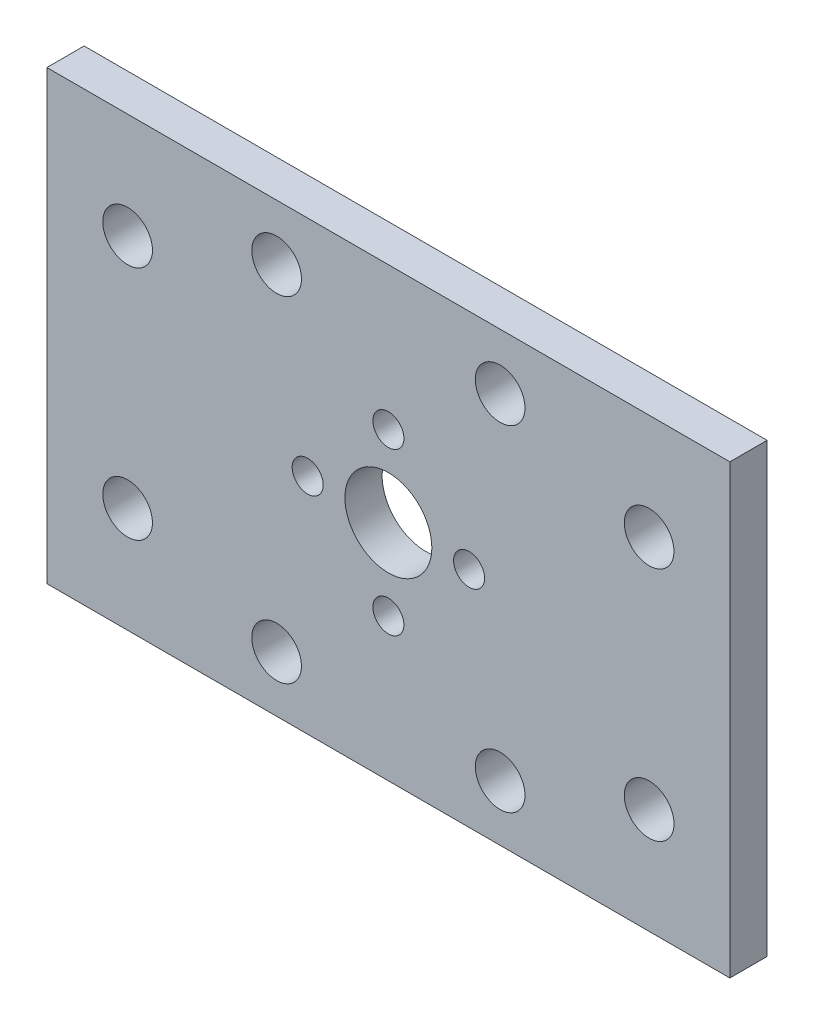
from build123d import *

# Parameters (mm, degrees)
SKETCH1_W           = 55
SKETCH1_H           = 36
SKETCH1_R           = 2
SKETCH1_R_2         = 3.5
SKETCH1_R_3         = 1.25
BOSS_EXTRUDE1_DEPTH = 1.5


with BuildPart() as part:
    # Sketch1 → Boss-Extrude1 (new, symmetric)
    with BuildSketch(Plane.XY):
        Rectangle(SKETCH1_W, SKETCH1_H)
        with Locations((-9, 13.5)):
            Circle(SKETCH1_R, mode=Mode.SUBTRACT)
        with Locations((-21, 9.5)):
            Circle(SKETCH1_R, mode=Mode.SUBTRACT)
        with Locations(Location((-9, -13.5, 0), (0, 0, 180))):
            Circle(SKETCH1_R, mode=Mode.SUBTRACT)
        with Locations(Location((-21, -9.5, 0), (0, 0, 180))):
            Circle(SKETCH1_R, mode=Mode.SUBTRACT)
        with Locations((9, -13.5)):
            Circle(SKETCH1_R, mode=Mode.SUBTRACT)
        with Locations((21, -9.5)):
            Circle(SKETCH1_R, mode=Mode.SUBTRACT)
        with Locations(Location((9, 13.5, 0), (0, 0, 180))):
            Circle(SKETCH1_R, mode=Mode.SUBTRACT)
        with Locations(Location((21, 9.5, 0), (0, 0, 180))):
            Circle(SKETCH1_R, mode=Mode.SUBTRACT)
        Circle(SKETCH1_R_2, mode=Mode.SUBTRACT)
        with Locations((0, 6.5)):
            Circle(SKETCH1_R_3, mode=Mode.SUBTRACT)
        with Locations((6.5, 0)):
            Circle(SKETCH1_R_3, mode=Mode.SUBTRACT)
        with Locations((0, -6.5)):
            Circle(SKETCH1_R_3, mode=Mode.SUBTRACT)
        with Locations((-6.5, 0)):
            Circle(SKETCH1_R_3, mode=Mode.SUBTRACT)
    extrude(amount=BOSS_EXTRUDE1_DEPTH, both=True)


solid = part.part
